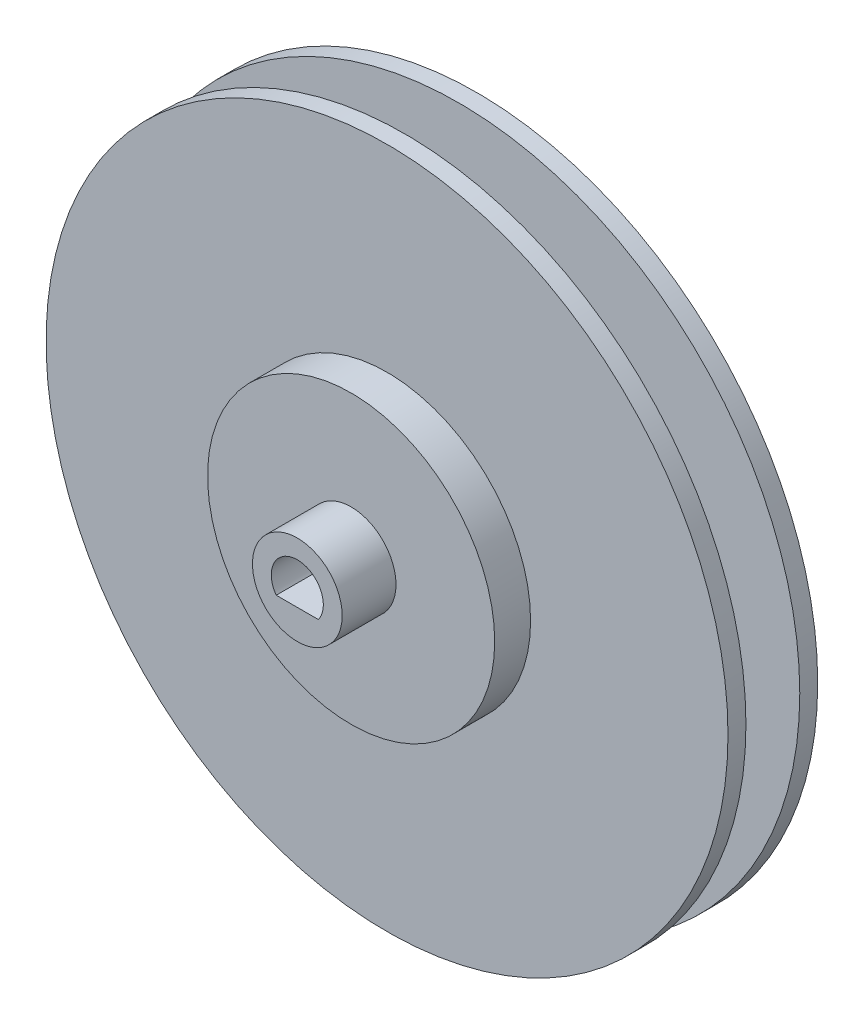
from build123d import *

# Parameters (mm, degrees)
SKETCH_1_W            = 3
SKETCH_1_H            = 1
CUT_EXTRUDE_START     = 0.339415
SKETCH_3_W            = 1.1
SKETCH_3_H            = 2.4
CUT_EXTRUDE_899_DEPTH = 4.668984
SKETCH_4_R            = 8
EXTRUDE_1_DEPTH       = 2
SKETCH_5_R            = 2.5
EXTRUDE_2_DEPTH       = 3
CUT_EXTRUDE_2_REACH   = 30.671


with BuildPart() as part:
    # 草图1 → Revolve 702 (revolve)
    with BuildSketch(Plane(origin=(0, 0, 0), x_dir=(0, 0, -1), z_dir=(1, 0, 0)), mode=Mode.PRIVATE) as revolve_702_sk:
        Polygon((1.5, 7), (1.5, 6), (2.5, 6), (2.5, 19), (1.5, 19), align=None)
        with Locations((0, 6.5)):
            Rectangle(SKETCH_1_W, SKETCH_1_H)
        Polygon((-2.5, 6), (-1.5, 6), (-1.5, 7), (-1.5, 19), (-2.5, 19), align=None)
    revolve(revolve_702_sk.sketch.rotate(Axis((0, 0, 1.65), (0, 0, -1)), 90), axis=Axis((0, 0, 1.65), (0, 0, -1)))

    # 草图3 → Cut-Extrude 899 (cut)
    with BuildSketch(Plane(origin=(0, 0, 0), x_dir=(1, 0, 0), z_dir=(0, 1, 0)).offset(CUT_EXTRUDE_START)):
        with Locations((-5.440392091, 0)):
            Rectangle(SKETCH_3_W, SKETCH_3_H)
    extrude(amount=CUT_EXTRUDE_899_DEPTH, mode=Mode.SUBTRACT)

    # 草图4 → 凸台-拉伸1 (add)
    with BuildSketch(Plane.XY.offset(2.5)):
        Circle(SKETCH_4_R)
    extrude(amount=EXTRUDE_1_DEPTH)

    # 草图5 → 凸台-拉伸2 (add)
    with BuildSketch(Plane.XY.offset(4.5)):
        Circle(SKETCH_5_R)
    extrude(amount=EXTRUDE_2_DEPTH)

    # 草图6 → 切除-拉伸2 (cut, up to next)
    with BuildSketch(Plane.XY.offset(7.5), mode=Mode.PRIVATE) as cut_extrude_2_sk1:
        with BuildLine():
            Line((-1.174734012, -0.85), (1.174734012, -0.85))
            ThreePointArc((1.174734012, -0.85), (1.379468071, -0.446730166), (1.45, 0))
            ThreePointArc((1.45, 0), (-0.446730166, 1.379468071), (-1.174734012, -0.85))
        make_face()
    cut_extrude_2_tool1 = extrude(cut_extrude_2_sk1.sketch, amount=-CUT_EXTRUDE_2_REACH, mode=Mode.PRIVATE) & part.part
    add(cut_extrude_2_tool1.solids().sort_by_distance((0, 0.192371, 7.5))[0], mode=Mode.SUBTRACT)


solid = part.part
